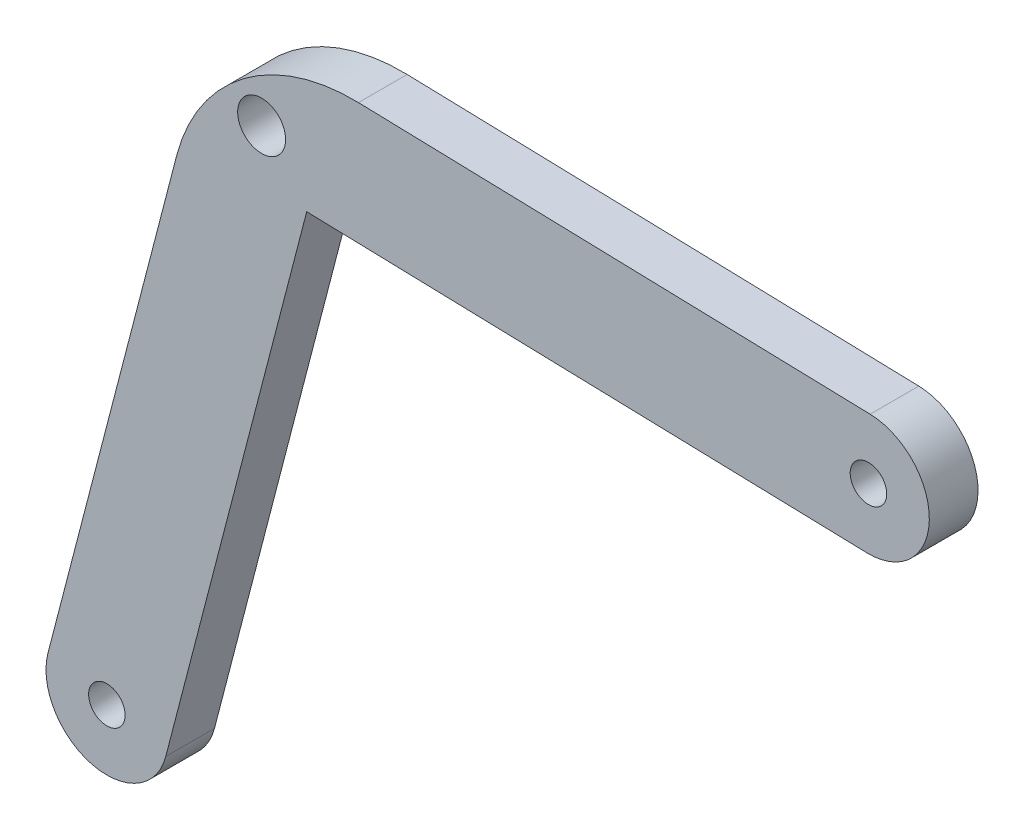
from build123d import *

# Parameters (mm, degrees)
ESQUISSE1_R        = 1.970435897
ESQUISSE1_R_2      = 1.5
BOSS_EXTRU_1_DEPTH = 4
CONG_1_R           = 15


with BuildPart() as part:
    # Esquisse1 → Boss.-Extru.1 (new body)
    with BuildSketch(Plane.XY):
        with BuildLine():
            Line((55.516963126, 17.477838302), (1.560034717, 18.956280867))
            Line((1.560034717, 18.956280867), (-12.018183396, -33.285157749))
            ThreePointArc((-12.018183396, -33.285157749), (-8.436742053, -39.382146998), (-2.339752804, -35.800705656))
            Line((-2.339752804, -35.800705656), (9.237508154, 8.74216165))
            Line((9.237508154, 8.74216165), (55.243061715, 7.481590105))
            ThreePointArc((55.243061715, 7.481590105), (60.378136519, 12.342763498), (55.516963126, 17.477838302))
        make_face()
        with Locations((5.534972738, 13.003723761)):
            Circle(ESQUISSE1_R, mode=Mode.SUBTRACT)
        with Locations((-7.1789681, -34.542931702)):
            Circle(ESQUISSE1_R_2, mode=Mode.SUBTRACT)
        with Locations((55.380012421, 12.479714203)):
            Circle(ESQUISSE1_R_2, mode=Mode.SUBTRACT)
    extrude(amount=BOSS_EXTRU_1_DEPTH)

    # Congé1
    cong_1_edges = [part.edges().sort_by_distance(p)[0] for p in [
        (1.560034717, 18.956280867, 2),
    ]]
    fillet(cong_1_edges, radius=CONG_1_R)


solid = part.part
